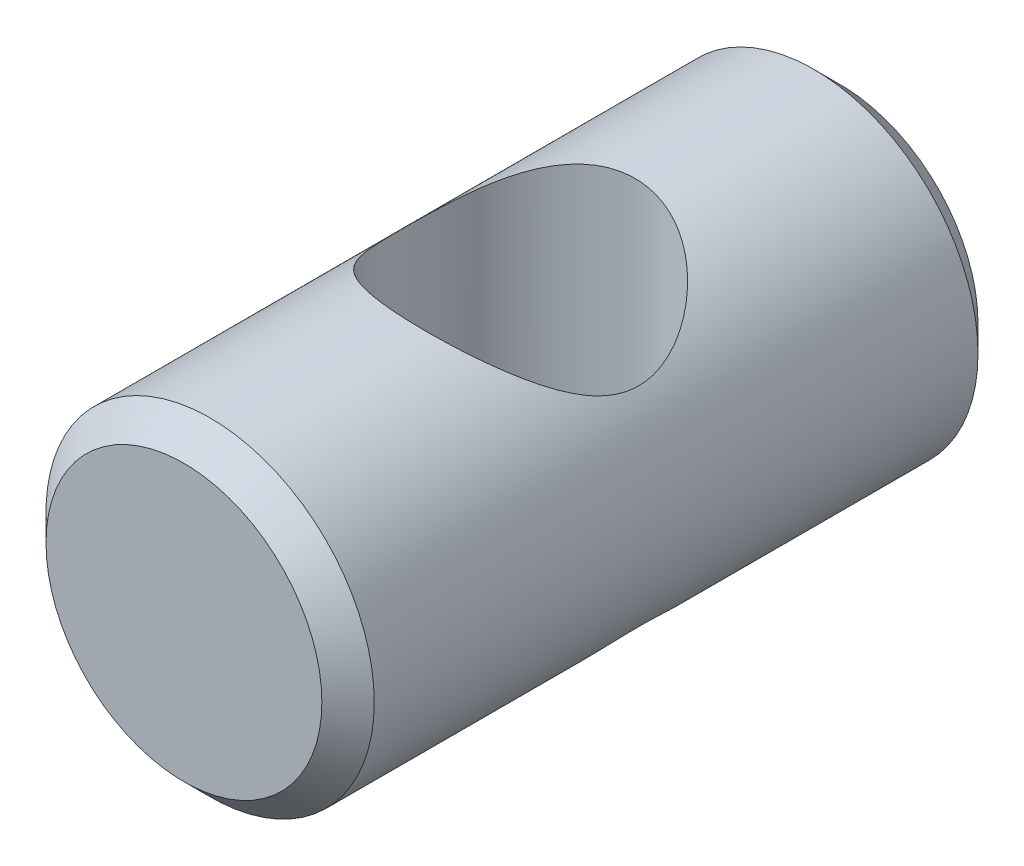
from build123d import *

# Parameters (mm, degrees)
SKETCH1_R               = 4.765
BOSS_EXTRUDE1_DEPTH     = 9.525
CUT_EXTRUDE1_DEPTH      = 12.667736499
CUT_EXTRUDE1_DEPTH_BACK = 12.667736499
SKETCH2_R               = 3.43
CHAMFER1_SIZE           = 0.76


with BuildPart() as part:
    # Sketch1 → Boss-Extrude1 (new, symmetric)
    with BuildSketch(Plane.XY):
        with Locations(Location((0, 0, 0), (0, 0, 180))):
            Circle(SKETCH1_R)
    extrude(amount=BOSS_EXTRUDE1_DEPTH, both=True)

    # Sketch2 → Cut-Extrude1 (cut, two sides: drawn at the far end of the back side and taken through both)
    with BuildSketch(Plane(origin=(0, 0, 0), x_dir=(1, 0, 0), z_dir=(0, 1, 0)).offset(-CUT_EXTRUDE1_DEPTH_BACK)):
        with Locations(Location((0.25, 0, 0), (0, 0, 270))):
            Circle(SKETCH2_R)
    extrude(amount=CUT_EXTRUDE1_DEPTH + CUT_EXTRUDE1_DEPTH_BACK, mode=Mode.SUBTRACT)

    # Chamfer1
    chamfer1_edges = [part.edges().sort_by_distance(p)[0] for p in [
        (4.765, 0, -9.525),
        (4.765, 0, 9.525),
    ]]
    chamfer(chamfer1_edges, length=CHAMFER1_SIZE)


solid = part.part
